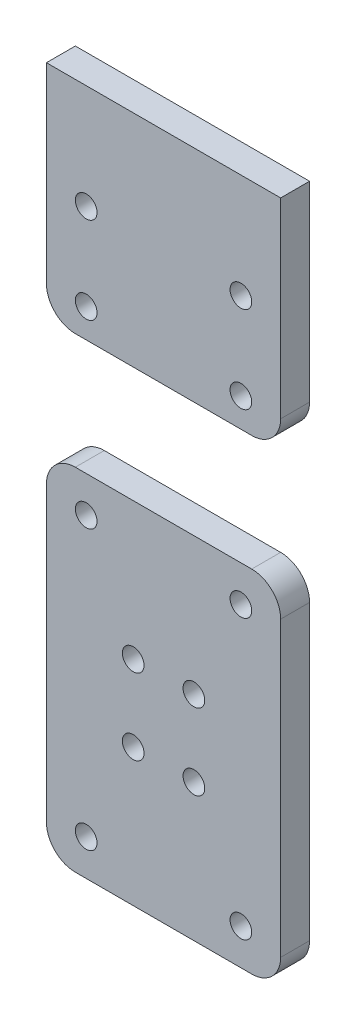
from build123d import *

# Parameters (mm, degrees)
SKETCH1_R           = 0.75
SKETCH1_W           = 4.2
SKETCH1_H           = 8
BOSS_EXTRUDE1_DEPTH = 2
SKETCH2_W           = 8.2
SKETCH2_H           = 8
CUT_EXTRUDE1_DEPTH  = 2


with BuildPart() as part:
    # Sketch1 → Boss-Extrude1 (new body)
    with BuildSketch(Plane.XY):
        with BuildLine():
            Line((4, 44.7), (4, 52.7))
            Line((4, 52.7), (2, 52.7))
            ThreePointArc((2, 52.7), (0.585786438, 53.285786438), (0, 54.7))
            Line((0, 54.7), (0, 67.93))
            Line((0, 67.93), (16.2, 67.93))
            Line((16.2, 67.93), (16.2, 54.7))
            ThreePointArc((16.2, 54.7), (15.614213562, 53.285786438), (14.2, 52.7))
            Line((14.2, 52.7), (12.2, 52.7))
            Line((12.2, 52.7), (12.2, 44.7))
            Line((12.2, 44.7), (14.2, 44.7))
            ThreePointArc((14.2, 44.7), (15.614213562, 44.114213562), (16.2, 42.7))
            Line((16.2, 42.7), (16.2, 22.44))
            ThreePointArc((16.2, 22.44), (15.614213562, 21.025786438), (14.2, 20.44))
            Line((14.2, 20.44), (12.2, 20.44))
            Line((12.2, 20.44), (12.2, 12.44))
            Line((12.2, 12.44), (10.2, 12.44))
            Line((10.2, 12.44), (10.2, 20.44))
            Line((10.2, 20.44), (6, 20.44))
            Line((6, 20.44), (6, 12.44))
            Line((6, 12.44), (4, 12.44))
            Line((4, 12.44), (4, 20.44))
            Line((4, 20.44), (2, 20.44))
            ThreePointArc((2, 20.44), (0.585786438, 21.025786438), (0, 22.44))
            Line((0, 22.44), (0, 42.7))
            ThreePointArc((0, 42.7), (0.585786438, 44.114213562), (2, 44.7))
            Line((2, 44.7), (4, 44.7))
        make_face()
        with Locations((2.75, 60.7)):
            Circle(SKETCH1_R, mode=Mode.SUBTRACT)
        with Locations(Location((13.45, 54.7, 0), (0, 0, 180))):
            Circle(SKETCH1_R, mode=Mode.SUBTRACT)
        with Locations(Location((13.45, 42.2, 0), (0, 0, 180))):
            Circle(SKETCH1_R, mode=Mode.SUBTRACT)
        with Locations(Location((13.45, 22.94, 0), (0, 0, 180))):
            Circle(SKETCH1_R, mode=Mode.SUBTRACT)
        with Locations(Location((10.2, 29.94, 0), (0, 0, 180))):
            Circle(SKETCH1_R, mode=Mode.SUBTRACT)
        with Locations((6, 35.2)):
            Circle(SKETCH1_R, mode=Mode.SUBTRACT)
        with Locations(Location((13.45, 60.7, 0), (0, 0, 180))):
            Circle(SKETCH1_R, mode=Mode.SUBTRACT)
        with Locations(Location((10.2, 35.2, 0), (0, 0, 180))):
            Circle(SKETCH1_R, mode=Mode.SUBTRACT)
        with Locations((6, 29.94)):
            Circle(SKETCH1_R, mode=Mode.SUBTRACT)
        with Locations((2.75, 22.94)):
            Circle(SKETCH1_R, mode=Mode.SUBTRACT)
        with Locations((2.75, 42.2)):
            Circle(SKETCH1_R, mode=Mode.SUBTRACT)
        with Locations((2.75, 54.7)):
            Circle(SKETCH1_R, mode=Mode.SUBTRACT)
        with Locations((8.1, 48.7)):
            Rectangle(SKETCH1_W, SKETCH1_H, mode=Mode.SUBTRACT)
    extrude(amount=BOSS_EXTRUDE1_DEPTH)

    # Sketch2 → Cut-Extrude1 (cut)
    with BuildSketch(Plane.XY.offset(2)):
        with Locations((8.1, 16.44)):
            Rectangle(SKETCH2_W, SKETCH2_H)
        with Locations((8.1, 48.7)):
            Rectangle(SKETCH2_W, SKETCH2_H)
    extrude(amount=-CUT_EXTRUDE1_DEPTH, mode=Mode.SUBTRACT)


with BuildPart() as cut_extrude1_piece_1:
    # of the separate pieces the step leaves, piece 1, a body of its own (cut_extrude1_pieces)
    add(part.part.solids().sort_by_distance((0, 42.7, 0))[0])


with BuildPart() as cut_extrude1_piece_2:
    # of the separate pieces the step leaves, piece 2, a body of its own (cut_extrude1_pieces)
    add(part.part.solids().sort_by_distance((2, 52.7, 0))[0])


solid = Compound([cut_extrude1_piece_1.part, cut_extrude1_piece_2.part])
